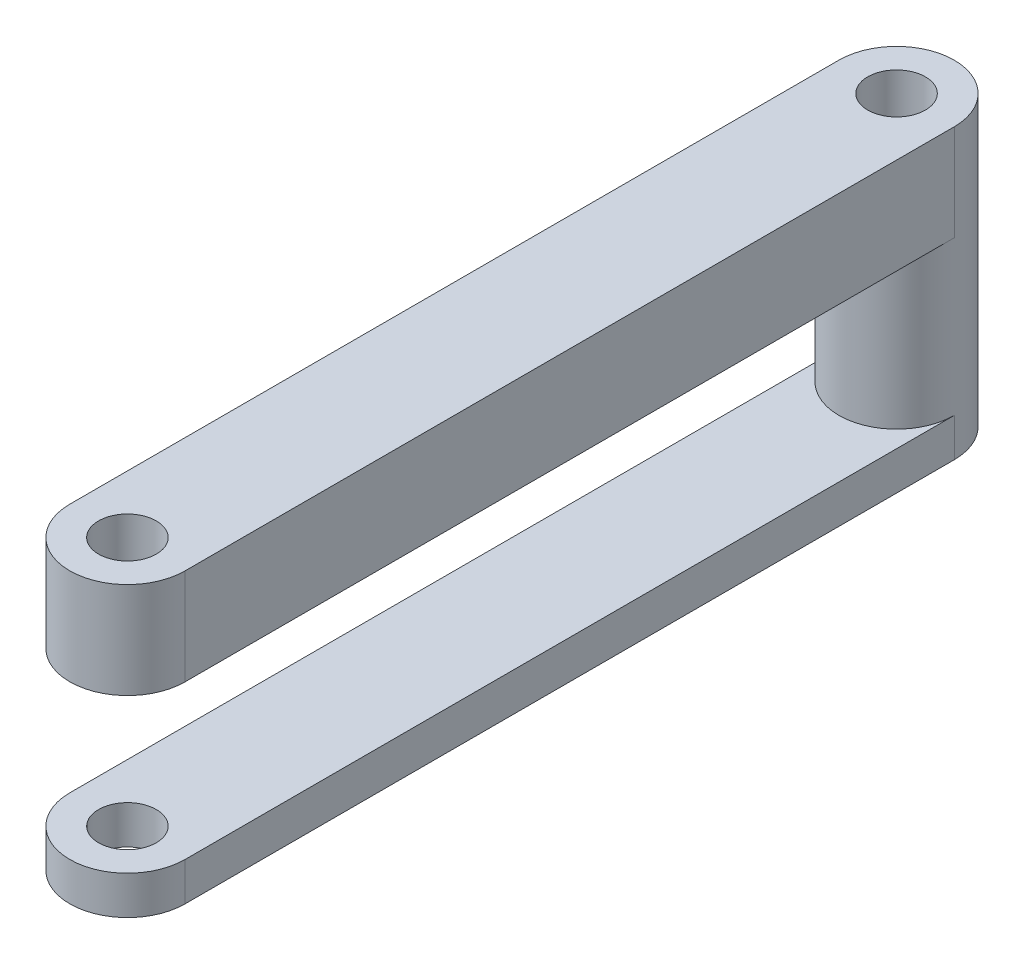
from build123d import *
from build123d.topology import SkipClean

# Parameters (mm, degrees)
BOSS_EXTRUDE1_DEPTH             = 2
SKETCH2_R                       = 3
BOSS_EXTRUDE2_DEPTH             = 12
BOSS_EXTRUDE3_START             = 10
BOSS_EXTRUDE3_DEPTH             = 5
F_3_0MM_CLEARANCE_DOWEL_HOLE1_D = 3


with BuildPart() as part:
    # Sketch1 → Boss-Extrude1 (new body)
    with BuildSketch(Plane(origin=(0, 0, 0), x_dir=(1, 0, 0), z_dir=(0, 1, 0))):
        with BuildLine():
            Line((3, 0), (3, -40))
            ThreePointArc((3, -40), (0, -43), (-3, -40))
            Line((-3, -40), (-3, 0))
            ThreePointArc((-3, 0), (0, 3), (3, 0))
        make_face()
    extrude(amount=BOSS_EXTRUDE1_DEPTH)

    # Sketch2 → Boss-Extrude2 (add)
    with SkipClean():  # the faces are left unmerged after this step: merging them gives an invalid solid
        with BuildSketch(Plane(origin=(0, 2, 0), x_dir=(1, 0, 0), z_dir=(0, 1, 0))):
            Circle(SKETCH2_R)
        extrude(amount=BOSS_EXTRUDE2_DEPTH)
    add(part.part.scale(1), mode=Mode.REPLACE)  # the faces are merged on a copy

    # Sketch1<3> → Boss-Extrude3 (add)
    with BuildSketch(Plane(origin=(0, 0, 0), x_dir=(1, 0, 0), z_dir=(0, 1, 0)).offset(BOSS_EXTRUDE3_START)):
        with BuildLine():
            Line((3, 0), (3, -40))
            ThreePointArc((3, -40), (0, -43), (-3, -40))
            Line((-3, -40), (-3, 0))
            ThreePointArc((-3, 0), (0, 3), (3, 0))
        make_face()
    extrude(amount=BOSS_EXTRUDE3_DEPTH)

    # Ø3.0mm Clearance Dowel Hole1 (through all)
    with Locations(Plane(origin=(0, 15, 0), x_dir=(1, 0, 0), z_dir=(0, 1, 0))):
        with Locations((0, 0), (0, -40)):
            Hole(F_3_0MM_CLEARANCE_DOWEL_HOLE1_D / 2)


solid = part.part
